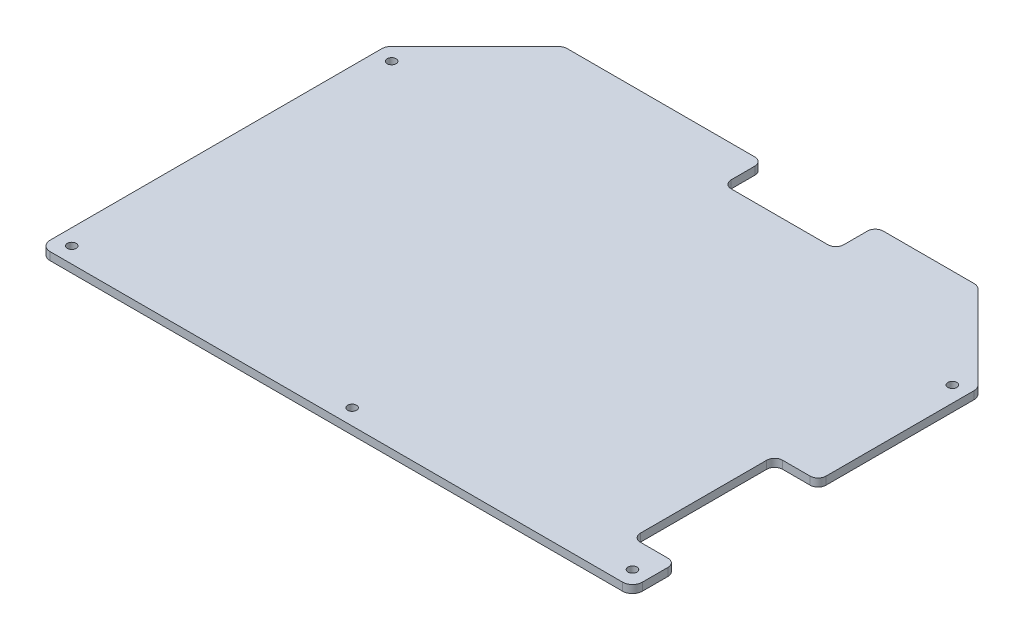
from build123d import *

# Parameters (mm, degrees)
MAIN_EXTRUSION_DEPTH    = 4
CORNER_LEAVE_R          = 5
D_GAGEMENT_M41_D        = 4.5
ESQUISSE4_W             = 22
ESQUISSE4_H             = 72
ENL_V_MAT_EXTRU_1_DEPTH = 4
ENL_V_MAT_EXTRU_2_DEPTH = 4
CONG_1_R                = 4


with BuildPart() as part:
    # Main scetch → Main extrusion (new body)
    with BuildSketch(Plane(origin=(0, 0, 0), x_dir=(1, 0, 0), z_dir=(0, 1, 0))):
        Polygon((-150, 0), (150, 0), (150, 175), (105, 220), (-105, 220), (-150, 175), align=None)
    extrude(amount=MAIN_EXTRUSION_DEPTH)

    # Corner leave
    corner_leave_edges = [part.edges().sort_by_distance(p)[0] for p in [
        (150, 2, 0),
        (-150, 2, 0),
        (-150, 2, -175),
        (-105, 2, -220),
        (105, 2, -220),
        (150, 2, -175),
    ]]
    fillet(corner_leave_edges, radius=CORNER_LEAVE_R)

    # Dégagement M41 (through all)
    with Locations(Plane(origin=(0, 4, 0), x_dir=(1, 0, 0), z_dir=(0, 1, 0))):
        with Locations((-142, 8), (-142, 170), (142, 170), (142, 8), (0, 8)):
            Hole(D_GAGEMENT_M41_D / 2)

    # Esquisse4 → Enlèv. mat.-Extru.1 (cut)
    with BuildSketch(Plane(origin=(0, 4, 0), x_dir=(1, 0, 0), z_dir=(0, 1, 0))):
        with Locations((139, 58)):
            Rectangle(ESQUISSE4_W, ESQUISSE4_H)
    extrude(amount=-ENL_V_MAT_EXTRU_1_DEPTH, mode=Mode.SUBTRACT)

    # Esquisse5 → Enlèv. mat.-Extru.2 (cut)
    with BuildSketch(Plane(origin=(0, 4, 0), x_dir=(1, 0, 0), z_dir=(0, 1, 0))):
        Polygon((36.3, 200), (53, 200), (53, 220), (-4, 220), (-4, 200), align=None)
    extrude(amount=-ENL_V_MAT_EXTRU_2_DEPTH, mode=Mode.SUBTRACT)

    # Congé1
    cong_1_edges = [part.edges().sort_by_distance(p)[0] for p in [
        (150, 2, -94),
        (150, 2, -22),
        (128, 2, -22),
        (128, 2, -94),
        (53, 2, -220),
        (53, 2, -200),
        (-4, 2, -200),
        (-4, 2, -220),
    ]]
    fillet(cong_1_edges, radius=CONG_1_R)


solid = part.part
